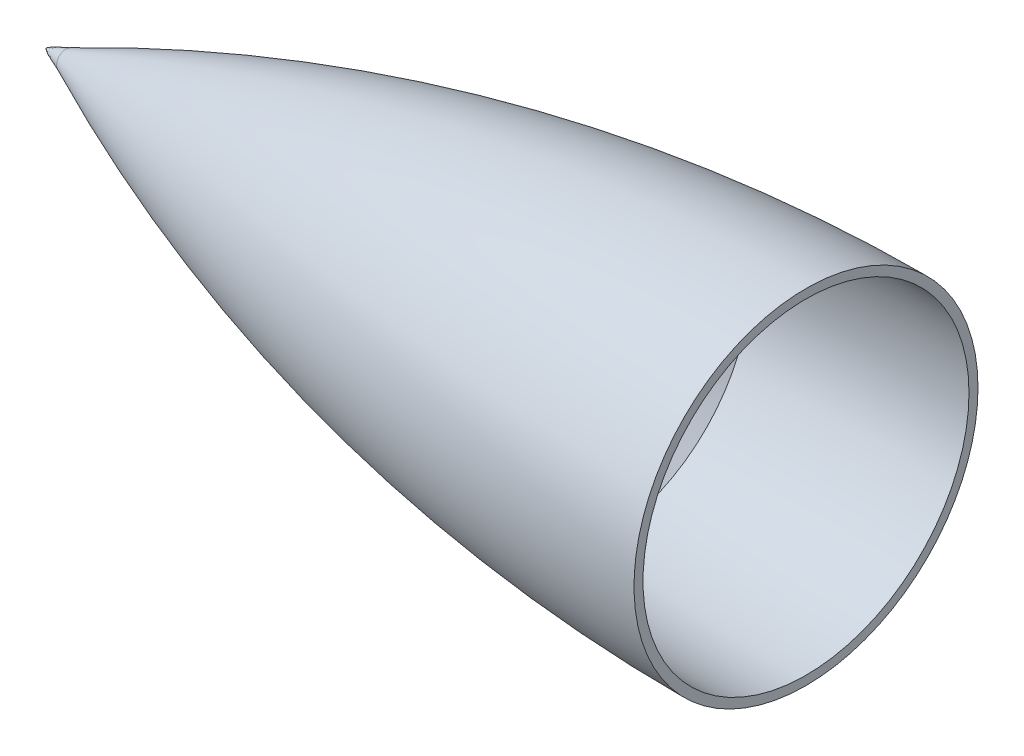
from build123d import *


with BuildPart() as part:
    # Sketch2 → Revolve3 (revolve)
    with BuildSketch(Plane.XY, mode=Mode.PRIVATE) as revolve3_sk:
        with BuildLine():
            Line((0, 441.26744186), (0, 439.01744186))
            ThreePointArc((0, 439.01744186), (-25.902181449, 438.25265687), (-51.714117738, 435.960966469))
            Line((-51.714117738, 435.960966469), (-54.872218632, 432.802865575))
            ThreePointArc((-54.872218632, 432.802865575), (-117.74890794, 420.076749543), (-178.079548465, 398.26744186))
            Line((-178.079548465, 398.26744186), (-190, 398.26744186))
            ThreePointArc((-190, 398.26744186), (-97.402515368, 430.38320744), (0, 441.26744186))
        make_face()
    revolve(revolve3_sk.sketch.rotate(Axis((-190, 398.26744186, 0), (-1, 0, 0)), 90), axis=Axis((-190, 398.26744186, 0), (-1, 0, 0)))

    # Sketch3 → Cut-Revolve3 (revolve, cut)
    with BuildSketch(Plane.XY, mode=Mode.PRIVATE) as cut_revolve3_sk:
        with BuildLine():
            Line((-190, 398.26744186), (-185, 398.26744186))
            Line((-185, 398.26744186), (-185, 400.614472088))
            ThreePointArc((-185, 400.614472088), (-187.503672331, 399.448780332), (-190, 398.26744186))
        make_face()
    revolve(cut_revolve3_sk.sketch.rotate(Axis((-190, 398.26744186, 0), (1, 0, 0)), 180), axis=Axis((-190, 398.26744186, 0), (1, 0, 0)), mode=Mode.SUBTRACT)

    # Sketch4 → Revolve4 (revolve)
    with BuildSketch(Plane.XY, mode=Mode.PRIVATE) as revolve4_sk:
        with BuildLine():
            Line((-185, 398.26744186), (-185, 400.614472088))
            add(Edge.make_bspline(
                [(-185, 400.614472088), (-186.994315071, 399.772437375), (-189.334509225, 399.059068758), (-189.991001923, 398.26744186)],
                knots=[0, 0, 0, 0, 1, 1, 1, 1], degree=3))
            Line((-189.991001923, 398.26744186), (-185, 398.26744186))
        make_face()
    revolve(revolve4_sk.sketch.rotate(Axis((-185, 398.26744186, 0), (-1, 0, 0)), 180), axis=Axis((-185, 398.26744186, 0), (-1, 0, 0)))


solid = part.part
